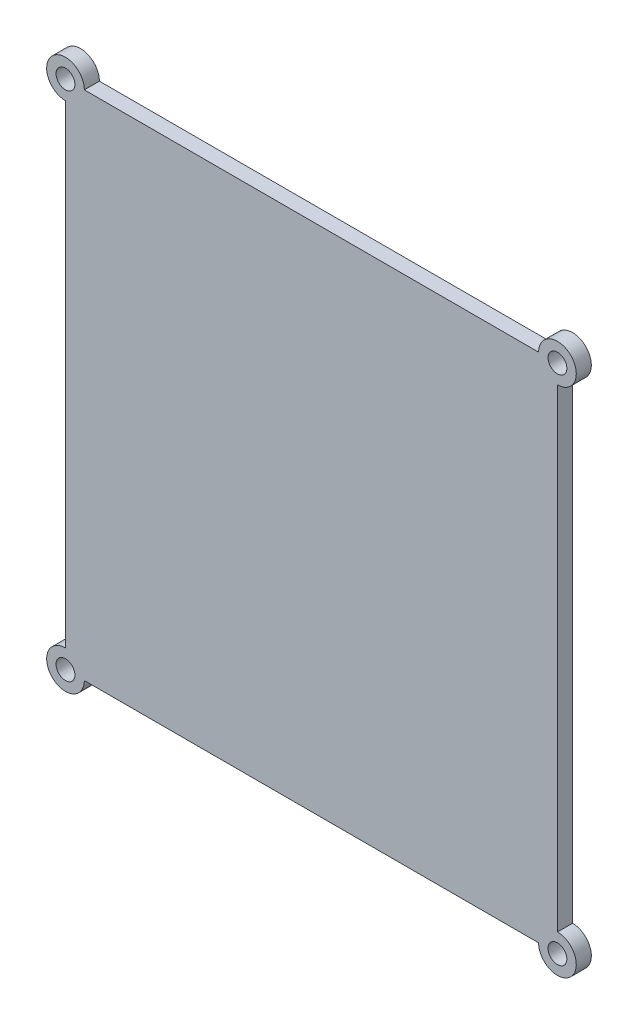
from build123d import *

# Parameters (mm, degrees)
SKETCH_1_R      = 1.25
EXTRUDE_1_DEPTH = 2


with BuildPart() as part:
    # 草图1 → 凸台-拉伸1 (new body)
    with BuildSketch(Plane.XY):
        with BuildLine():
            Line((30.15, 33.95), (-30.15, 33.95))
            ThreePointArc((-30.15, 33.95), (-34.417766953, 35.717766953), (-32.65, 31.45))
            Line((-32.65, 31.45), (-32.65, -31.45))
            ThreePointArc((-32.65, -31.45), (-34.417766953, -35.717766953), (-30.15, -33.95))
            Line((-30.15, -33.95), (30.15, -33.95))
            ThreePointArc((30.15, -33.95), (34.417766953, -35.717766953), (32.65, -31.45))
            Line((32.65, -31.45), (32.65, 31.45))
            ThreePointArc((32.65, 31.45), (34.417766953, 35.717766953), (30.15, 33.95))
        make_face()
        with Locations((-32.65, 33.95)):
            Circle(SKETCH_1_R, mode=Mode.SUBTRACT)
        with Locations((32.65, 33.95)):
            Circle(SKETCH_1_R, mode=Mode.SUBTRACT)
        with Locations((32.65, -33.95)):
            Circle(SKETCH_1_R, mode=Mode.SUBTRACT)
        with Locations((-32.65, -33.95)):
            Circle(SKETCH_1_R, mode=Mode.SUBTRACT)
    extrude(amount=EXTRUDE_1_DEPTH)


solid = part.part
